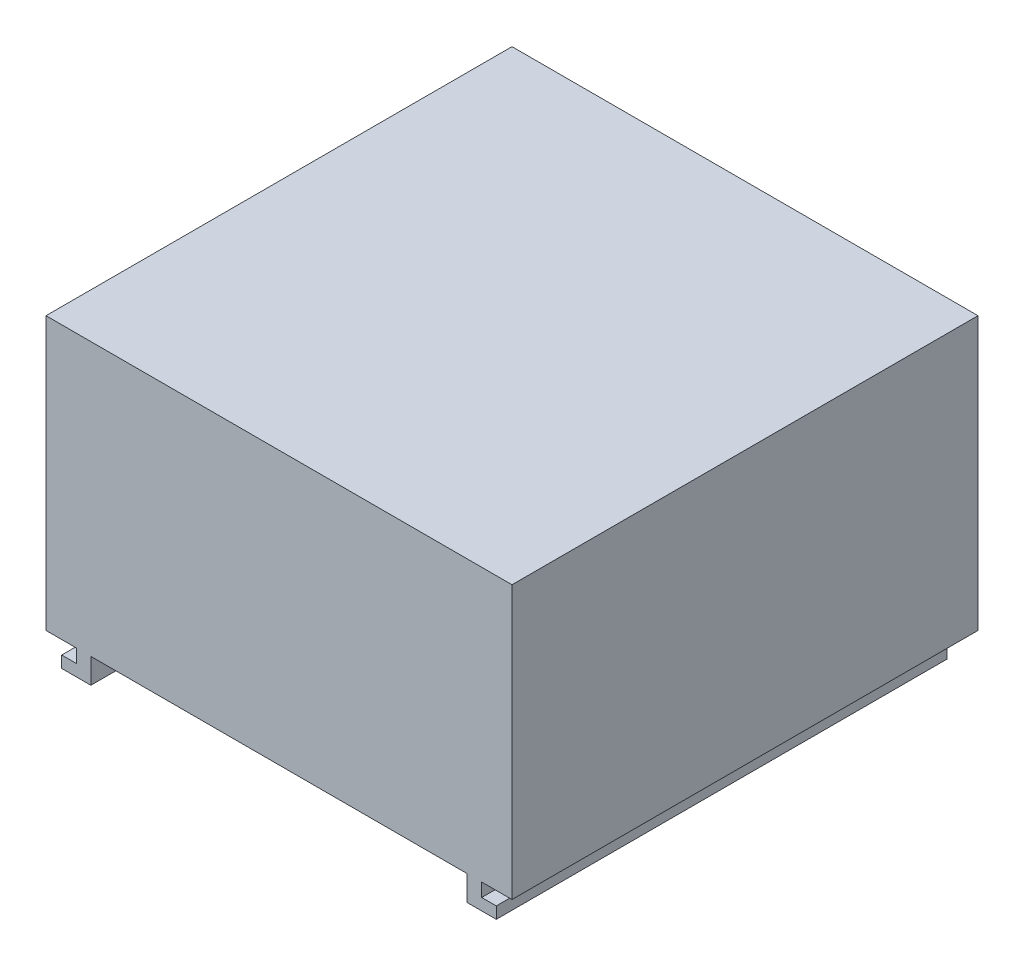
from build123d import *

# Parameters (mm, degrees)
SKETCH1_W           = 80
SKETCH1_H           = 80
BOSS_EXTRUDE3_DEPTH = 2
BOSS_EXTRUDE5_DEPTH = 77.35
CUT_EXTRUDE1_REACH  = 58.918
SKETCH7_W           = 64.6
SKETCH7_H           = 77
SKETCH5_W           = 80
SKETCH5_H           = 80
SKETCH5_W_2         = 77
SKETCH5_H_2         = 77
BOSS_EXTRUDE6_DEPTH = 44.8
SKETCH8_W           = 80
SKETCH8_H           = 80
BOSS_EXTRUDE7_DEPTH = 1.5


with BuildPart() as part:
    # Sketch1 → Boss-Extrude3 (new body)
    with BuildSketch(Plane(origin=(0, 0, 0), x_dir=(1, 0, 0), z_dir=(0, 1, 0))):
        Rectangle(SKETCH1_W, SKETCH1_H)
    extrude(amount=-BOSS_EXTRUDE3_DEPTH)

    # Sketch3 → Boss-Extrude5 (add)
    with BuildSketch(Plane.XY.offset(40)):
        Polygon((-32.3, -2), (-34.8, -2), (-34.8, -4.3), (-37.3, -4.3), (-37.3, -6.3), (-32.3, -6.3), align=None)
        Polygon((32.3, -6.3), (37.3, -6.3), (37.3, -4.3), (34.8, -4.3), (34.8, -2), (32.3, -2), align=None)
    extrude(amount=-BOSS_EXTRUDE5_DEPTH)

    # Sketch7 → Cut-Extrude1 (cut, up to next)
    with BuildSketch(Plane(origin=(0, 0, 0), x_dir=(1, 0, 0), z_dir=(0, 1, 0)), mode=Mode.PRIVATE) as cut_extrude1_sk1:
        Rectangle(SKETCH7_W, SKETCH7_H)
    cut_extrude1_tool1 = extrude(cut_extrude1_sk1.sketch, amount=-CUT_EXTRUDE1_REACH, mode=Mode.PRIVATE) & part.part
    add(cut_extrude1_tool1.solids().sort_by_distance((0, 0, 0))[0], mode=Mode.SUBTRACT)

    # Sketch5 → Boss-Extrude6 (add)
    with BuildSketch(Plane(origin=(0, 0, 0), x_dir=(1, 0, 0), z_dir=(0, 1, 0))):
        Rectangle(SKETCH5_W, SKETCH5_H)
        Rectangle(SKETCH5_W_2, SKETCH5_H_2, mode=Mode.SUBTRACT)
    extrude(amount=BOSS_EXTRUDE6_DEPTH)

    # Sketch8 → Boss-Extrude7 (add)
    with BuildSketch(Plane(origin=(0, 44.8, 0), x_dir=(1, 0, 0), z_dir=(0, 1, 0))):
        Rectangle(SKETCH8_W, SKETCH8_H)
    extrude(amount=-BOSS_EXTRUDE7_DEPTH)


solid = part.part
